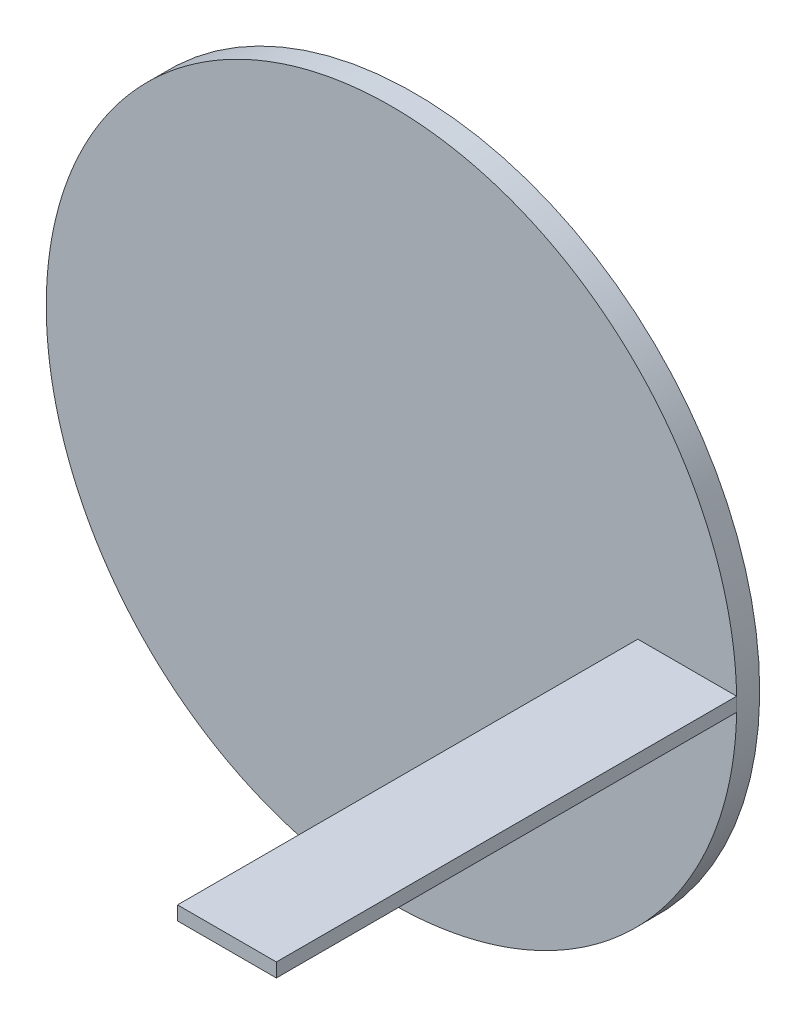
from build123d import *

# Parameters (mm, degrees)
ESBO_O1_R                = 75
RESSALTO_EXTRUS_O1_DEPTH = 5
ESBO_O2_R                = 10
RESSALTO_EXTRUS_O2_DEPTH = 30
ESBO_O4_W                = 21.468474511
ESBO_O4_H                = 3.02321723
RESSALTO_EXTRUS_O3_DEPTH = 100


with BuildPart() as part:
    # Esboço1 → Ressalto-extrusão1 (new body)
    with BuildSketch(Plane(origin=(0, 0, 0), x_dir=(0, 1, 0), z_dir=(0, 0, 1))):
        with Locations(Location((0, 0, 0), (0, 0, 270))):
            Circle(ESBO_O1_R)
    extrude(amount=RESSALTO_EXTRUS_O1_DEPTH)

    # Esboço2 → Ressalto-extrusão2 (add)
    with BuildSketch(Plane.XY.offset(5)):
        Circle(ESBO_O2_R)
    extrude(amount=-RESSALTO_EXTRUS_O2_DEPTH)

    # Esboço4 → Ressalto-extrusão3 (add)
    with BuildSketch(Plane.XY.offset(5)):
        with Locations((64.250395504, -0.006564625)):
            Rectangle(ESBO_O4_W, ESBO_O4_H)
    extrude(amount=RESSALTO_EXTRUS_O3_DEPTH)


solid = part.part
